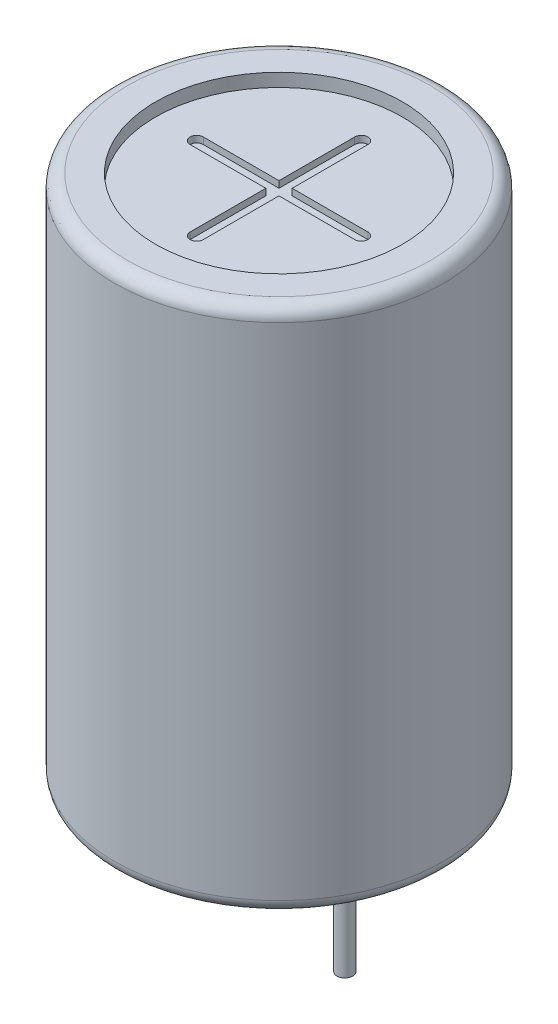
from build123d import *

# Parameters (mm, degrees)
SKETCH_2_R          = 6.25
EXTRUDE_1_DEPTH     = 20
FILLET_1_R          = 0.5
SKETCH_3_R          = 0.3
EXTRUDE_2_DEPTH     = 5
SKETCH_5_R          = 4.6875
CUT_EXTRUDE_1_DEPTH = 1
EXTRUDE_START       = 0.5
SKETCH_6_R          = 4.6875
EXTRUDE_3_DEPTH     = 0.5
CUT_EXTRUDE_2_DEPTH = 0.25
CUT_EXTRUDE_3_DEPTH = 0.25


with BuildPart() as part:
    # 草图2 → 凸台-拉伸1 (new body)
    with BuildSketch(Plane(origin=(0, 0, 0), x_dir=(1, 0, 0), z_dir=(0, 1, 0))):
        with Locations(Location((0, 0, 0), (0, 0, 270))):
            Circle(SKETCH_2_R)
    extrude(amount=EXTRUDE_1_DEPTH)

    # 圆角1
    fillet_1_edges = [part.edges().sort_by_distance(p)[0] for p in [
        (0, 0, -6.25),
        (0, 20, -6.25),
    ]]
    fillet(fillet_1_edges, radius=FILLET_1_R)

    # 草图3 → 凸台-拉伸2 (add)
    with BuildSketch(Plane.XZ):
        with Locations(Location((-2.5, 0, 0), (0, 0, 90))):
            Circle(SKETCH_3_R)
        with Locations(Location((2.5, 0, 0), (0, 0, 90))):
            Circle(SKETCH_3_R)
    extrude(amount=EXTRUDE_2_DEPTH)

    # 草图5 → 切除-拉伸1 (cut)
    with BuildSketch(Plane(origin=(0, 20, 0), x_dir=(1, 0, 0), z_dir=(0, 1, 0))):
        with Locations(Location((0, 0, 0), (0, 0, 270))):
            Circle(SKETCH_5_R)
    extrude(amount=-CUT_EXTRUDE_1_DEPTH, mode=Mode.SUBTRACT)

    # 草图6 → 凸台-拉伸3 (add)
    with BuildSketch(Plane(origin=(0, 19, 0), x_dir=(1, 0, 0), z_dir=(0, 1, 0)).offset(EXTRUDE_START)):
        with Locations(Location((0, 0, 0), (0, 0, 270))):
            Circle(SKETCH_6_R)
    extrude(amount=-EXTRUDE_3_DEPTH)

    # 草图7 → 切除-拉伸2 (cut)
    with BuildSketch(Plane(origin=(0, 19.5, 0), x_dir=(1, 0, 0), z_dir=(0, 1, 0))):
        with BuildLine():
            Line((-3.125, 0.25), (3.125, 0.25))
            ThreePointArc((3.125, 0.25), (3.375, 0), (3.125, -0.25))
            Line((3.125, -0.25), (-3.125, -0.25))
            ThreePointArc((-3.125, -0.25), (-3.375, 0), (-3.125, 0.25))
        make_face()
    extrude(amount=-CUT_EXTRUDE_2_DEPTH, mode=Mode.SUBTRACT)

    # 草图8 → 切除-拉伸3 (cut)
    with BuildSketch(Plane(origin=(0, 19.5, 0), x_dir=(1, 0, 0), z_dir=(0, 1, 0))):
        with BuildLine():
            Line((-0.25, -3.125), (-0.25, 3.125))
            ThreePointArc((-0.25, 3.125), (0, 3.375), (0.25, 3.125))
            Line((0.25, 3.125), (0.25, -3.125))
            ThreePointArc((0.25, -3.125), (0, -3.375), (-0.25, -3.125))
        make_face()
    extrude(amount=-CUT_EXTRUDE_3_DEPTH, mode=Mode.SUBTRACT)


solid = part.part
